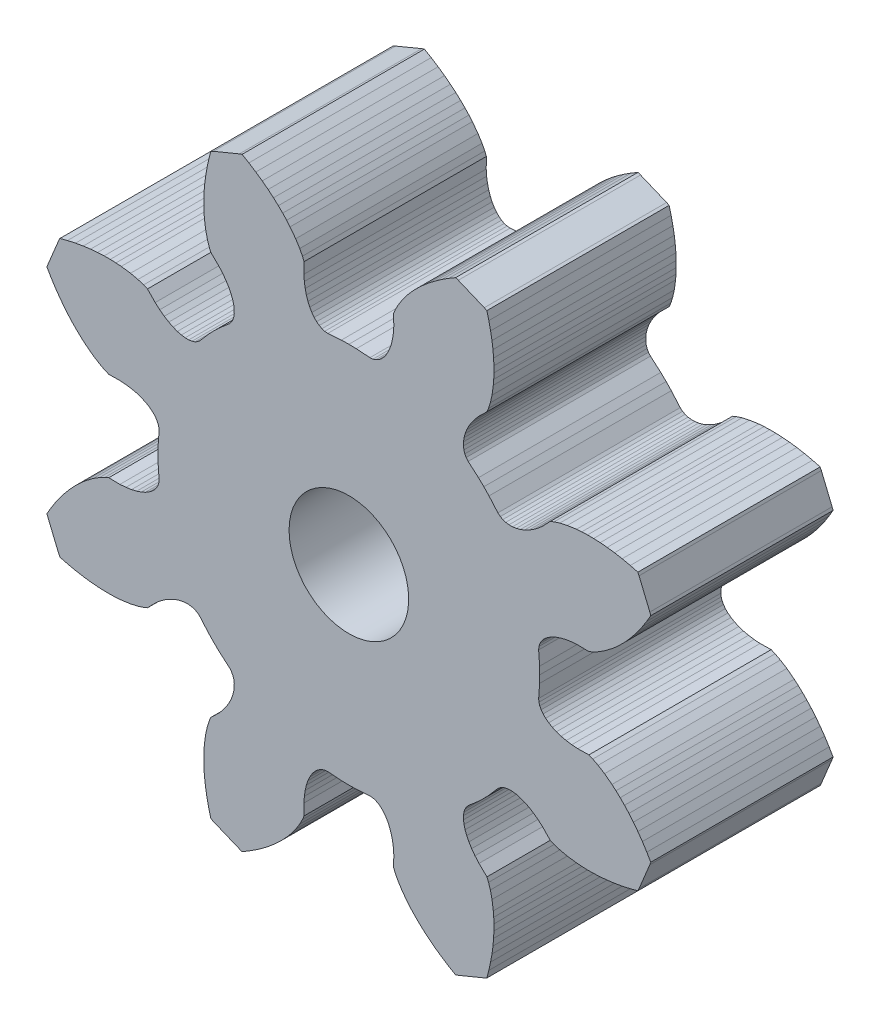
from build123d import *

# Parameters (mm, degrees)
SKETCH1_R           = 1.2499975
BOSS_EXTRUDE1_DEPTH = 3.81


with BuildPart() as part:
    # Sketch1 → Boss-Extrude1 (new body)
    with BuildSketch(Plane.XY):
        Polygon((-6.533950514, 0.072254508), (-6.570804261, 0.241033986), (-6.598978684, 0.402602949), (-6.619408478, 0.555492587), (-6.633161869, 0.701038181), (-6.639571216, 0.837904451), (-6.640372385, 0.966224925), (-6.636099487, 1.085732546), (-6.627420162, 1.196560843), (-6.600447492, 1.389241846), (-6.565062554, 1.544267933), (-6.528208807, 1.663107914), (-6.494025622, 1.74496062), (-6.328050233, 1.905728414), (-6.244862246, 2.001334511), (-6.174492954, 2.096272968), (-6.117342941, 2.189742615), (-6.07180987, 2.281075814), (-6.037626684, 2.369471395), (-6.015193969, 2.45346055), (-6.004244667, 2.533176807), (-6.003577027, 2.607017829), (-6.012923992, 2.674449504), (-6.032686146, 2.735204775), (-6.060860568, 2.788883058), (-6.102120741, 2.838822556), (-6.317367987, 3.024293043), (-6.429531565, 3.13298489), (-6.537422244, 3.245281996), (-6.723693899, 3.459728074), (-6.773766925, 3.501655887), (-6.826510512, 3.529963837), (-6.887399311, 3.548791295), (-6.954697458, 3.558271788), (-7.028672008, 3.558271788), (-7.108521792, 3.546654846), (-7.192510947, 3.524222131), (-7.280773001, 3.490840113), (-7.371972671, 3.445173514), (-7.465442319, 3.387222332), (-7.561181944, 3.316986568), (-7.656120401, 3.234466222), (-7.816888195, 3.067823193), (-7.898740901, 3.034441176), (-8.017580882, 2.996786261), (-8.172606969, 2.961267794), (-8.36608914, 2.934428653), (-8.476249796, 2.925749328), (-8.59562389, 2.92147643), (-8.723810835, 2.922945239), (-8.860810633, 2.929354586), (-9.006356228, 2.942440337), (-9.159913506, 2.962736603), (-9.320814829, 2.991044554), (-9.489460779, 3.0278983), (-9.648225652, 3.069959642), (-9.673729513, 3.123504397), (-9.898857837, 3.666830108), (-9.918486463, 3.7219772), (-9.835966116, 3.863917536), (-9.743297637, 4.009596659), (-9.649026821, 4.143525312), (-9.554756005, 4.26597055), (-9.461286357, 4.378267656), (-9.369285518, 4.479748988), (-9.278887015, 4.570948658), (-9.191159074, 4.652801364), (-9.107169919, 4.724639465), (-8.952010304, 4.842010637), (-8.817280483, 4.92680096), (-8.706585714, 4.983817446), (-8.625267121, 5.0188018), (-8.393462394, 5.014261845), (-8.267545426, 5.023742338), (-8.150975422, 5.041234515), (-8.043485327, 5.06647132), (-7.94721159, 5.098251), (-7.861085986, 5.136707084), (-7.785776155, 5.181038403), (-7.72114857, 5.228707923), (-7.668404983, 5.280917398), (-7.627011282, 5.33606449), (-7.598035691, 5.392413335), (-7.580677042, 5.449696876), (-7.574935335, 5.514324461), (-7.595231602, 5.798205134), (-7.598035691, 5.95403239), (-7.595231602, 6.10959259), (-7.574935335, 6.392939151), (-7.580677042, 6.458100848), (-7.598035691, 6.51538439), (-7.627011282, 6.572000291), (-7.668404983, 6.627013855), (-7.72114857, 6.678422161), (-7.785776155, 6.727026378), (-7.861085986, 6.770423), (-7.94721159, 6.808745556), (-8.043485327, 6.841459932), (-8.150975422, 6.866830265), (-8.267545426, 6.884055386), (-8.393462394, 6.892734711), (-8.625267121, 6.889262981), (-8.706585714, 6.92317911), (-8.817280483, 6.98126382), (-8.952010304, 7.066054143), (-9.107169919, 7.183425316), (-9.191159074, 7.25499636), (-9.278887015, 7.336982594), (-9.369285518, 7.427381096), (-9.461286357, 7.528862428), (-9.554756005, 7.641827174), (-9.649026821, 7.764272413), (-9.743297637, 7.898334593), (-9.835966116, 8.043880188), (-9.918486463, 8.185152884), (-9.898857837, 8.241101145), (-9.673729513, 8.784960967), (-9.648225652, 8.837838082), (-9.489460779, 8.879899424), (-9.320814829, 8.916886699), (-9.159913506, 8.945194649), (-9.006356228, 8.965357388), (-8.860810633, 8.978443138), (-8.723810835, 8.984852486), (-8.59562389, 8.985653654), (-8.476249796, 8.981380756), (-8.36608914, 8.973369072), (-8.172606969, 8.945728762), (-8.017580882, 8.911144992), (-7.898740901, 8.873490077), (-7.816888195, 8.84010806), (-7.656120401, 8.67346503), (-7.561181944, 8.590811156), (-7.465442319, 8.520575392), (-7.371972671, 8.46262421), (-7.280773001, 8.417091139), (-7.192510947, 8.382907953), (-7.108521792, 8.361276406), (-7.028672008, 8.349659464), (-6.954697458, 8.348991824), (-6.887399311, 8.359006429), (-6.826510512, 8.377833887), (-6.773766925, 8.406141837), (-6.723693899, 8.448203179), (-6.537422244, 8.662515729), (-6.429531565, 8.774946362), (-6.317367987, 8.882837041), (-6.102120741, 9.069108697), (-6.060860568, 9.119048194), (-6.032686146, 9.171791781), (-6.012923992, 9.23268058), (-6.003577027, 9.300913423), (-6.004244667, 9.374754445), (-6.015193969, 9.454470702), (-6.037626684, 9.538459857), (-6.07180987, 9.62672191), (-6.117342941, 9.718188637), (-6.174492954, 9.811524757), (-6.244862246, 9.906463213), (-6.328050233, 10.00206931), (-6.494025622, 10.162970633), (-6.528208807, 10.24468981), (-6.565062554, 10.363529791), (-6.600447492, 10.518555879), (-6.627420162, 10.711370409), (-6.636099487, 10.821397538), (-6.640372385, 10.941706327), (-6.639571216, 11.070026801), (-6.633161869, 11.206091903), (-6.619408478, 11.352438665), (-6.598978684, 11.505194776), (-6.570804261, 11.666763738), (-6.533950514, 11.835009104), (-6.492556813, 11.99430809), (-6.439679698, 12.019678423), (-5.89555282, 12.245073802), (-5.840005143, 12.264435372), (-5.697931278, 12.181247386), (-5.553053324, 12.088445378), (-5.418991144, 11.99430809), (-5.295878265, 11.900838442), (-5.183581159, 11.806567626), (-5.082233355, 11.714566787), (-4.990900156, 11.624835925), (-4.908913922, 11.537107984), (-4.83720935, 11.453118829), (-4.719971706, 11.297291573), (-4.635181382, 11.16269528), (-4.577897841, 11.052534624), (-4.543848184, 10.97054839), (-4.547453441, 10.739544832), (-4.538774117, 10.613627863), (-4.5206143, 10.496123163), (-4.496178663, 10.389701293), (-4.463464286, 10.292492859), (-4.425141731, 10.206367255), (-4.380810412, 10.131057424), (-4.333140892, 10.066429839), (-4.280797889, 10.014353893), (-4.226451965, 9.973227248), (-4.17010312, 9.94331696), (-4.112018411, 9.926091839), (-4.047657882, 9.920083076), (-3.764311321, 9.940512871), (-3.607949953, 9.94331696), (-3.452256225, 9.940512871), (-3.168776136, 9.920083076), (-3.104415607, 9.926091839), (-3.046464425, 9.94331696), (-2.989848524, 9.973227248), (-2.935769657, 10.014353893), (-2.883426654, 10.066429839), (-2.834955965, 10.131057424), (-2.791425815, 10.206367255), (-2.753103259, 10.292492859), (-2.720388882, 10.389701293), (-2.695152077, 10.496123163), (-2.677793428, 10.613627863), (-2.668980576, 10.739544832), (-2.672719362, 10.97054839), (-2.638669704, 11.052534624), (-2.581252635, 11.16269528), (-2.49659584, 11.297291573), (-2.379358196, 11.453118829), (-2.306852455, 11.537107984), (-2.225533861, 11.624835925), (-2.13433419, 11.714566787), (-2.032852858, 11.806567626), (-1.920689281, 11.900838442), (-1.797576402, 11.99430809), (-1.663514221, 12.088445378), (-1.518636267, 12.181247386), (-1.376562402, 12.264435372), (-1.321548838, 12.245073802), (-0.777555488, 12.019678423), (-0.724010732, 11.99430809), (-0.682617031, 11.835009104), (-0.645763284, 11.666763738), (-0.616787694, 11.505194776), (-0.596357899, 11.352438665), (-0.583405676, 11.206091903), (-0.576862801, 11.070026801), (-0.576195161, 10.941706327), (-0.580468059, 10.821397538), (-0.589147383, 10.711370409), (-0.615986525, 10.518555879), (-0.650703823, 10.363529791), (-0.688358738, 10.24468981), (-0.722541924, 10.162970633), (-0.888250256, 10.00206931), (-0.971705299, 9.906463213), (-1.041273423, 9.811524757), (-1.099091076, 9.718188637), (-1.144757676, 9.62672191), (-1.178940861, 9.538459857), (-1.201373577, 9.454470702), (-1.212322878, 9.374754445), (-1.212856991, 9.300913423), (-1.203510026, 9.23268058), (-1.1838814, 9.171791781), (-1.155706977, 9.119048194), (-1.114313276, 9.069108697), (-0.899199558, 8.882837041), (-0.787035981, 8.774946362), (-0.679145301, 8.662515729), (-0.492873646, 8.448203179), (-0.44280062, 8.406141837), (-0.389923505, 8.377833887), (-0.329168234, 8.359006429), (-0.261870088, 8.348991824), (-0.18709437, 8.349659464), (-0.108045753, 8.361276406), (-0.02325543, 8.382907953), (0.064205455, 8.417091139), (0.155405126, 8.46262421), (0.249675942, 8.520575392), (0.344614399, 8.590811156), (0.440354024, 8.67346503), (0.600320649, 8.84010806), (0.682173355, 8.873490077), (0.801013336, 8.911144992), (0.956840592, 8.945728762), (1.149521595, 8.973369072), (1.259682251, 8.981380756), (1.379056344, 8.985653654), (1.507376818, 8.984852486), (1.644243088, 8.978443138), (1.790589851, 8.965357388), (1.943479489, 8.945194649), (2.104247283, 8.916886699), (2.273026762, 8.879899424), (2.431791635, 8.837838082), (2.457161968, 8.784960967), (2.682290291, 8.241101145), (2.701918917, 8.185152884), (2.619398571, 8.043880188), (2.526730092, 7.898334593), (2.432459275, 7.764272413), (2.338321987, 7.641827174), (2.244852339, 7.528862428), (2.1528515, 7.427381096), (2.06231947, 7.336982594), (1.974591529, 7.25499636), (1.890602374, 7.183425316), (1.735576287, 7.066054143), (1.600712938, 6.98126382), (1.490018169, 6.92317911), (1.408833103, 6.889262981), (1.176894849, 6.892734711), (1.05097788, 6.884055386), (0.934407876, 6.866830265), (0.827184838, 6.841459932), (0.730777572, 6.808745556), (0.64451844, 6.770423), (0.56920861, 6.727026378), (0.504714553, 6.678422161), (0.451837437, 6.627013855), (0.411244905, 6.572000291), (0.381601674, 6.51538439), (0.364109497, 6.458100848), (0.35836779, 6.392939151), (0.378797584, 6.10959259), (0.381601674, 5.95403239), (0.378797584, 5.798205134), (0.35836779, 5.514324461), (0.364109497, 5.449696876), (0.381601674, 5.392413335), (0.411244905, 5.33606449), (0.451837437, 5.280917398), (0.504714553, 5.228707923), (0.56920861, 5.181038403), (0.64451844, 5.136707084), (0.730777572, 5.098251), (0.827184838, 5.06647132), (0.934407876, 5.041234515), (1.05097788, 5.023742338), (1.176894849, 5.014261845), (1.408833103, 5.0188018), (1.490018169, 4.983817446), (1.600712938, 4.92680096), (1.735576287, 4.842010637), (1.890602374, 4.724639465), (1.974591529, 4.652801364), (2.06231947, 4.570948658), (2.1528515, 4.479748988), (2.244852339, 4.378267656), (2.338321987, 4.26597055), (2.432459275, 4.143525312), (2.526730092, 4.009596659), (2.619398571, 3.863917536), (2.701918917, 3.7219772), (2.682290291, 3.666830108), (2.457161968, 3.123504397), (2.431791635, 3.069959642), (2.273026762, 3.0278983), (2.104247283, 2.991044554), (1.943479489, 2.962736603), (1.790589851, 2.942440337), (1.644243088, 2.929354586), (1.507376818, 2.922945239), (1.379056344, 2.92147643), (1.259682251, 2.925749328), (1.149521595, 2.934428653), (0.956840592, 2.961267794), (0.801013336, 2.996786261), (0.682173355, 3.034441176), (0.600320649, 3.067823193), (0.440354024, 3.234466222), (0.344614399, 3.316986568), (0.249675942, 3.387222332), (0.155405126, 3.445173514), (0.064205455, 3.490840113), (-0.02325543, 3.524222131), (-0.108045753, 3.546654846), (-0.18709437, 3.558271788), (-0.261870088, 3.558271788), (-0.329168234, 3.548791295), (-0.389923505, 3.529963837), (-0.44280062, 3.501655887), (-0.492873646, 3.459728074), (-0.679145301, 3.245281996), (-0.787035981, 3.13298489), (-0.899199558, 3.024293043), (-1.114313276, 2.838822556), (-1.155706977, 2.788883058), (-1.1838814, 2.735204775), (-1.203510026, 2.674449504), (-1.212856991, 2.607017829), (-1.212322878, 2.533176807), (-1.201373577, 2.45346055), (-1.178940861, 2.369471395), (-1.144757676, 2.281075814), (-1.099091076, 2.189742615), (-1.041273423, 2.096272968), (-0.971705299, 2.001334511), (-0.888250256, 1.905728414), (-0.722541924, 1.74496062), (-0.688358738, 1.663107914), (-0.650703823, 1.544267933), (-0.615986525, 1.389241846), (-0.589147383, 1.196560843), (-0.580468059, 1.085732546), (-0.576195161, 0.966224925), (-0.576862801, 0.837904451), (-0.583405676, 0.701038181), (-0.596357899, 0.555492587), (-0.616787694, 0.402602949), (-0.645763284, 0.241033986), (-0.682617031, 0.072254508), (-0.724010732, -0.086376838), (-0.777555488, -0.111747171), (-1.321548838, -0.336341382), (-1.376562402, -0.356637648), (-1.518636267, -0.273983774), (-1.663514221, -0.180647654), (-1.797576402, -0.087178006), (-1.920689281, 0.00709281), (-2.032852858, 0.101230098), (-2.13433419, 0.193230938), (-2.225533861, 0.283095328), (-2.306852455, 0.37068974), (-2.379358196, 0.454678895), (-2.49659584, 0.610506151), (-2.581252635, 0.744568332), (-2.638669704, 0.855396628), (-2.672719362, 0.937249334), (-2.668980576, 1.168252893), (-2.677793428, 1.294303389), (-2.695152077, 1.411006921), (-2.720388882, 1.51822996), (-2.753103259, 1.615304865), (-2.791425815, 1.701430469), (-2.834955965, 1.776873828), (-2.883426654, 1.840566717), (-2.935769657, 1.893443832), (-2.989848524, 1.934704005), (-3.046464425, 1.963679596), (-3.104415607, 1.981839413), (-3.168776136, 1.98758112), (-3.452256225, 1.967284854), (-3.607949953, 1.963679596), (-3.764311321, 1.967284854), (-4.047657882, 1.98758112), (-4.112018411, 1.981839413), (-4.17010312, 1.963679596), (-4.226451965, 1.934704005), (-4.280797889, 1.893443832), (-4.333140892, 1.840566717), (-4.380810412, 1.776873828), (-4.425141731, 1.701430469), (-4.463464286, 1.615304865), (-4.496178663, 1.51822996), (-4.5206143, 1.411006921), (-4.538774117, 1.294303389), (-4.547453441, 1.168252893), (-4.543848184, 0.937249334), (-4.577897841, 0.855396628), (-4.635181382, 0.744568332), (-4.719971706, 0.610506151), (-4.83720935, 0.454678895), (-4.908913922, 0.37068974), (-4.990900156, 0.283095328), (-5.082233355, 0.193230938), (-5.183581159, 0.101230098), (-5.295878265, 0.00709281), (-5.418991144, -0.087178006), (-5.553053324, -0.180647654), (-5.697931278, -0.273983774), (-5.840005143, -0.356637648), (-5.89555282, -0.336341382), (-6.439679698, -0.111747171), (-6.492556813, -0.086376838), align=None)
        with Locations(Location((-3.607949953, 5.95403239, 0), (0, 0, 180))):
            Circle(SKETCH1_R, mode=Mode.SUBTRACT)
    extrude(amount=BOSS_EXTRUDE1_DEPTH)


solid = part.part
